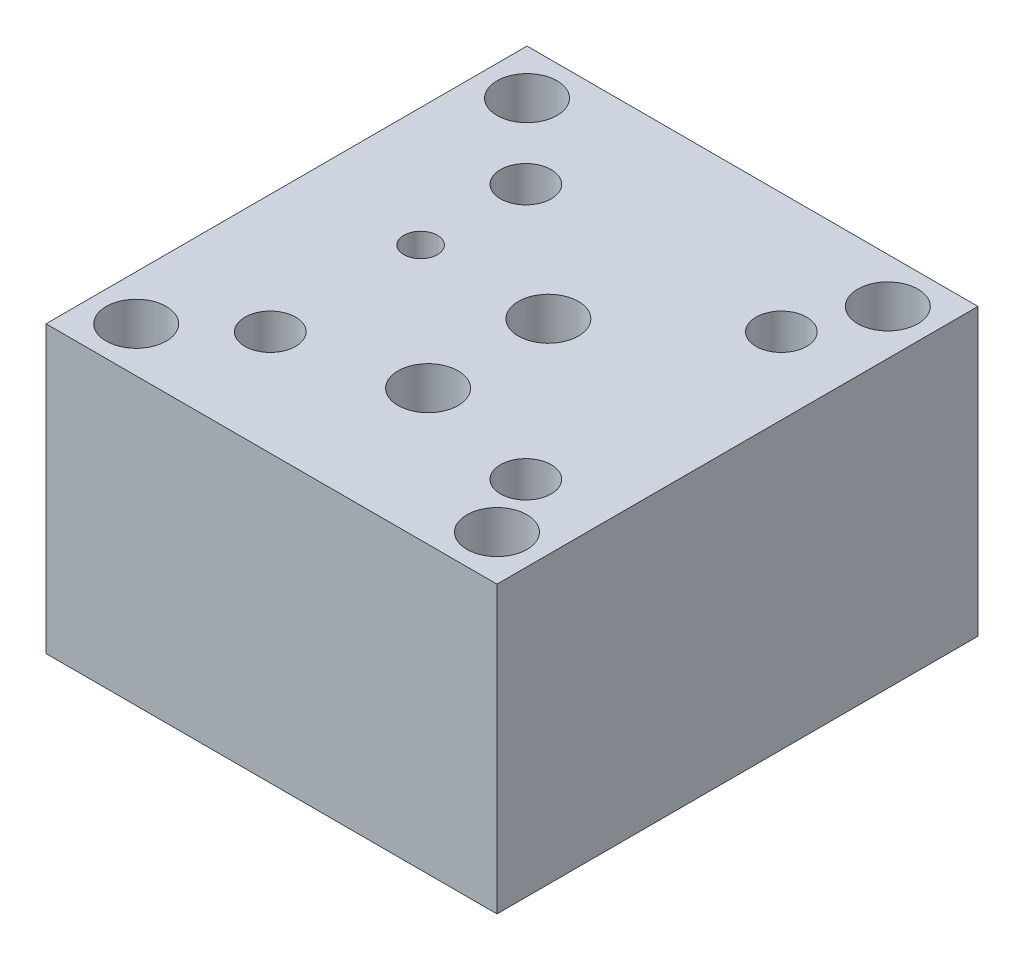
from build123d import *

# Parameters (mm, degrees)
SKETCH1_W           = 95.25
SKETCH1_H           = 101.6
BOSS_EXTRUDE1_DEPTH = 30.1625
CUT_EXTRUDE2_START  = 30.1625
SKETCH2_R           = 4.3688
CUT_EXTRUDE2_DEPTH  = 85.725
CUT_EXTRUDE4_START  = 30.1625
SKETCH3_R           = 6.35
CUT_EXTRUDE4_DEPTH  = 25.4
CUT_EXTRUDE6_START  = 30.1625
SKETCH4_R           = 5.3578125
CUT_EXTRUDE6_DEPTH  = 20.32
CUT_EXTRUDE8_START  = 30.1625
SKETCH5_R           = 6.35
CUT_EXTRUDE8_DEPTH  = 45.72
CUT_EXTRUDE10_START = 30.1625
SKETCH6_R           = 3.556
CUT_EXTRUDE10_DEPTH = 7.9375
CUT_EXTRUDE12_START = -47.625
SKETCH7_R           = 5.55625
CUT_EXTRUDE12_DEPTH = 53.34
CUT_EXTRUDE14_START = -50.8
SKETCH8_R           = 5.55625
CUT_EXTRUDE14_DEPTH = 53.34
CUT_EXTRUDE16_START = -30.1625
SKETCH9_R           = 6.35
CUT_EXTRUDE16_DEPTH = 27.94
CUT_EXTRUDE18_START = -30.1625
SKETCH10_R          = 12.7127
CUT_EXTRUDE18_DEPTH = 3.1242


with BuildPart() as part:
    # Sketch1 → Boss-Extrude1 (new, symmetric)
    with BuildSketch(Plane(origin=(0, 0, 0), x_dir=(1, 0, 0), z_dir=(0, 1, 0))):
        Rectangle(SKETCH1_W, SKETCH1_H)
    extrude(amount=BOSS_EXTRUDE1_DEPTH, both=True)

    # Sketch2 → Cut-Extrude2 (cut)
    with BuildSketch(Plane(origin=(0, 0, 0), x_dir=(1, 0, 0), z_dir=(0, 1, 0)).offset(CUT_EXTRUDE2_START)):
        with Locations(Location((-38.1, -41.275, 0), (0, 0, 270))):
            Circle(SKETCH2_R)
        with Locations(Location((38.1, -41.275, 0), (0, 0, 270))):
            Circle(SKETCH2_R)
        with Locations(Location((-38.1, 41.275, 0), (0, 0, 270))):
            Circle(SKETCH2_R)
        with Locations(Location((38.1, 41.275, 0), (0, 0, 270))):
            Circle(SKETCH2_R)
    extrude(amount=-CUT_EXTRUDE2_DEPTH, mode=Mode.SUBTRACT)

    # Sketch3 → Cut-Extrude4 (cut)
    with BuildSketch(Plane(origin=(0, 0, 0), x_dir=(1, 0, 0), z_dir=(0, 1, 0)).offset(CUT_EXTRUDE4_START)):
        with Locations(Location((-38.1, -41.275, 0), (0, 0, 270))):
            Circle(SKETCH3_R)
        with Locations(Location((38.1, -41.275, 0), (0, 0, 270))):
            Circle(SKETCH3_R)
        with Locations(Location((-38.1, 41.275, 0), (0, 0, 270))):
            Circle(SKETCH3_R)
        with Locations(Location((38.1, 41.275, 0), (0, 0, 270))):
            Circle(SKETCH3_R)
    extrude(amount=-CUT_EXTRUDE4_DEPTH, mode=Mode.SUBTRACT)

    # Sketch4 → Cut-Extrude6 (cut)
    with BuildSketch(Plane(origin=(0, 0, 0), x_dir=(1, 0, 0), z_dir=(0, 1, 0)).offset(CUT_EXTRUDE6_START)):
        with Locations(Location((-22.479, -28.575, 0), (0, 0, 270))):
            Circle(SKETCH4_R)
        with Locations(Location((31.496, -28.575, 0), (0, 0, 270))):
            Circle(SKETCH4_R)
        with Locations(Location((-22.479, 25.4, 0), (0, 0, 270))):
            Circle(SKETCH4_R)
        with Locations(Location((31.496, 25.4, 0), (0, 0, 270))):
            Circle(SKETCH4_R)
    extrude(amount=-CUT_EXTRUDE6_DEPTH, mode=Mode.SUBTRACT)

    # Sketch5 → Cut-Extrude8 (cut)
    with BuildSketch(Plane(origin=(0, 0, 0), x_dir=(1, 0, 0), z_dir=(0, 1, 0)).offset(CUT_EXTRUDE8_START)):
        with Locations(Location((4.5085, -22.225, 0), (0, 0, 270))):
            Circle(SKETCH5_R)
        with Locations(Location((4.5085, 3.175, 0), (0, 0, 270))):
            Circle(SKETCH5_R)
    extrude(amount=-CUT_EXTRUDE8_DEPTH, mode=Mode.SUBTRACT)

    # Sketch6 → Cut-Extrude10 (cut)
    with BuildSketch(Plane(origin=(0, 0, 0), x_dir=(1, 0, 0), z_dir=(0, 1, 0)).offset(CUT_EXTRUDE10_START)):
        with Locations(Location((-22.479, 3.175, 0), (0, 0, 270))):
            Circle(SKETCH6_R)
    extrude(amount=-CUT_EXTRUDE10_DEPTH, mode=Mode.SUBTRACT)

    # Sketch7 → Cut-Extrude12 (cut)
    with BuildSketch(Plane(origin=(0, 0, 0), x_dir=(0, 0, -1), z_dir=(1, 0, 0)).offset(CUT_EXTRUDE12_START)):
        with Locations(Location((-16.637, -11.1125, 0), (0, 0, 233.130102354))):
            Circle(SKETCH7_R)
    extrude(amount=CUT_EXTRUDE12_DEPTH, mode=Mode.SUBTRACT)

    # Sketch8 → Cut-Extrude14 (cut)
    with BuildSketch(Plane.XY.offset(CUT_EXTRUDE14_START)):
        with Locations(Location((10.16, -11.1125, 0), (0, 0, 233.130102354))):
            Circle(SKETCH8_R)
    extrude(amount=CUT_EXTRUDE14_DEPTH, mode=Mode.SUBTRACT)

    # Sketch9 → Cut-Extrude16 (cut)
    with BuildSketch(Plane(origin=(0, 0, 0), x_dir=(1, 0, 0), z_dir=(0, 1, 0)).offset(CUT_EXTRUDE16_START)):
        with Locations(Location((-28.575, -11.1125, 0), (0, 0, 270))):
            Circle(SKETCH9_R)
        with Locations(Location((15.875, 30.1625, 0), (0, 0, 270))):
            Circle(SKETCH9_R)
    extrude(amount=CUT_EXTRUDE16_DEPTH, mode=Mode.SUBTRACT)

    # Sketch10 → Cut-Extrude18 (cut)
    with BuildSketch(Plane(origin=(0, 0, 0), x_dir=(1, 0, 0), z_dir=(0, 1, 0)).offset(CUT_EXTRUDE18_START)):
        with Locations(Location((-28.575, -11.1125, 0), (0, 0, 270))):
            Circle(SKETCH10_R)
        with Locations(Location((15.875, 30.1625, 0), (0, 0, 270))):
            Circle(SKETCH10_R)
    extrude(amount=CUT_EXTRUDE18_DEPTH, mode=Mode.SUBTRACT)


solid = part.part
